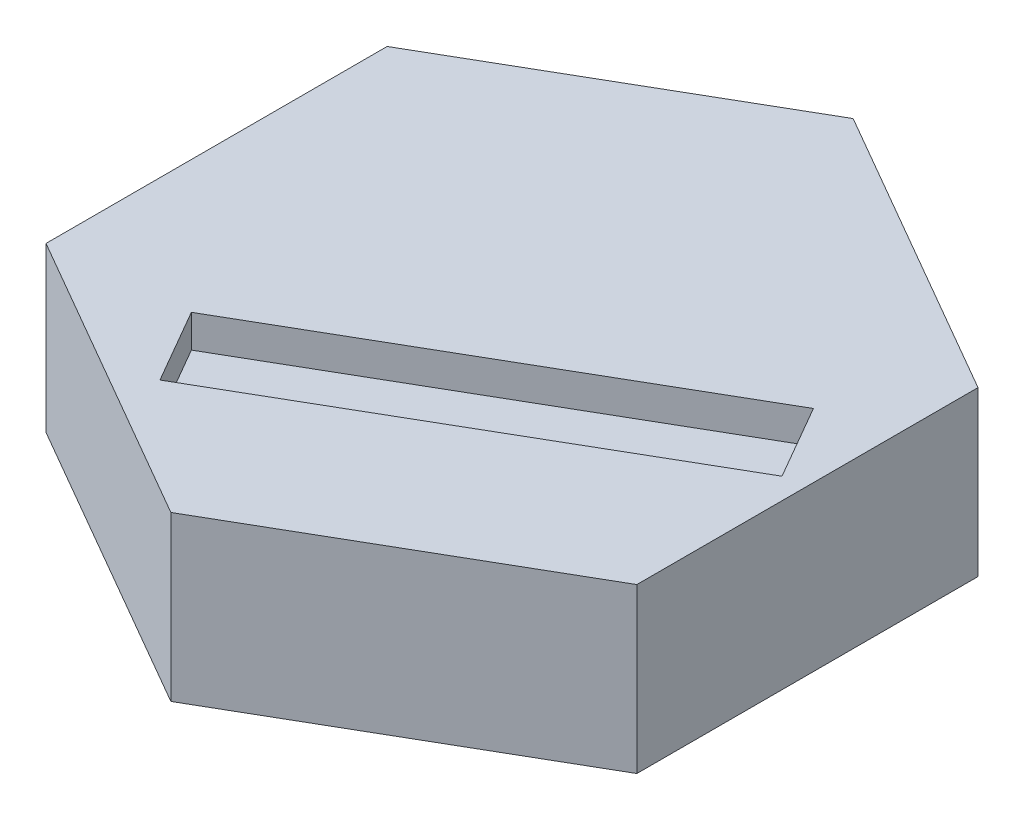
from build123d import *

# Parameters (mm, degrees)
BOSS_EXTRUDE1_DEPTH = 5
SHELL1_T            = -1
BOSS_EXTRUDE2_DEPTH = 2
SKETCH3_W           = 6.8
SKETCH3_H           = 4.9
BOSS_EXTRUDE3_DEPTH = 3.5
CUT_EXTRUDE1_DEPTH  = 3.5
CUT_EXTRUDE2_DEPTH  = 1


with BuildPart() as part:
    # Sketch1 → Boss-Extrude1 (new body)
    with BuildSketch(Plane(origin=(0, 0, 0), x_dir=(1, 0, 0), z_dir=(0, 1, 0))):
        Polygon((9.025, 5.210586179), (0, 10.421172359), (-9.025, 5.210586179), (-9.025, -5.210586179), (0, -10.421172359), (9.025, -5.210586179), align=None)
    extrude(amount=BOSS_EXTRUDE1_DEPTH)

    # Shell1
    shell1_openings = [part.faces().sort_by_distance(p)[0] for p in [
        (0, 0, 0),
    ]]
    offset(amount=SHELL1_T, openings=shell1_openings, kind=Kind.INTERSECTION)

    # Sketch2 → Boss-Extrude2 (add)
    with BuildSketch(Plane.XZ.offset(-4)):
        Polygon((8.025, -4.63323591), (8.025, 4.63323591), (0, 9.26647182), (-8.025, 4.63323591), (-8.025, -4.63323591), (0, -9.26647182), align=None)
    extrude(amount=BOSS_EXTRUDE2_DEPTH)

    # Sketch3 → Boss-Extrude3 (add)
    with BuildSketch(Plane.XZ.offset(-2)):
        Rectangle(SKETCH3_W, SKETCH3_H)
    extrude(amount=BOSS_EXTRUDE3_DEPTH)

    # Sketch4 → Cut-Extrude1 (cut)
    with BuildSketch(Plane.XZ.offset(1.5)):
        Polygon((2.1, -0.65), (2.1, 0.65), (0.75, 0.65), (0.75, 2.1), (-0.75, 2.1), (-0.75, 0.65), (-2.1, 0.65), (-2.1, -0.65), (-0.75, -0.65), (-0.75, -2.1), (0.75, -2.1), (0.75, -0.65), align=None)
    extrude(amount=-CUT_EXTRUDE1_DEPTH, mode=Mode.SUBTRACT)

    # Sketch5 → Cut-Extrude2 (cut)
    with BuildSketch(Plane(origin=(0, 5, 0), x_dir=(1, 0, 0), z_dir=(0, 1, 0))):
        Polygon((-4.981910893, -4.812655517), (7.063361543, 2.144475893), (8.375460902, -0.127158722), (-3.669811534, -7.084290132), align=None)
    extrude(amount=-CUT_EXTRUDE2_DEPTH, mode=Mode.SUBTRACT)


solid = part.part
